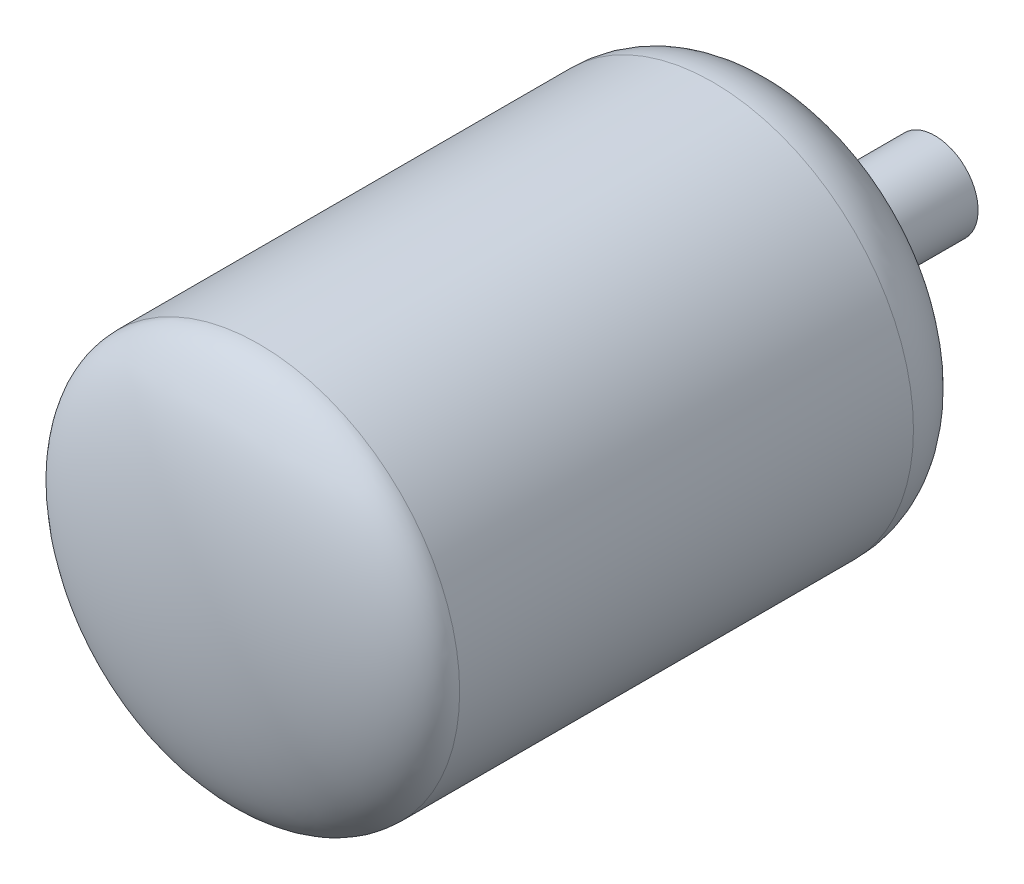
from build123d import *


with BuildPart() as part:
    # Sketch1 → Revolve1 (revolve)
    with BuildSketch(Plane.YZ, mode=Mode.PRIVATE) as revolve1_sk:
        with BuildLine():
            Line((0, 0), (12, 0))
            Line((12, 0), (12, 25))
            Line((12, 25), (45.88, 44.56062712))
            ThreePointArc((45.88, 44.56062712), (53.200508076, 51.881135196), (55.88, 61.881135196))
            Line((55.88, 61.881135196), (55.88, 188.28))
            add(Edge.make_bspline(
                [(55.88, 188.28), (55.88, 208.28), (0, 208.28)],
                knots=[0, 0, 0, 1.570796327, 1.570796327, 1.570796327], degree=2, weights=[1, 0.707106781, 1]))
            Line((0, 208.28), (0, 0))
        make_face()
    revolve(revolve1_sk.sketch.rotate(Axis((0, 0, 0), (0, 0, 1)), 90), axis=Axis((0, 0, 0), (0, 0, 1)))


solid = part.part
